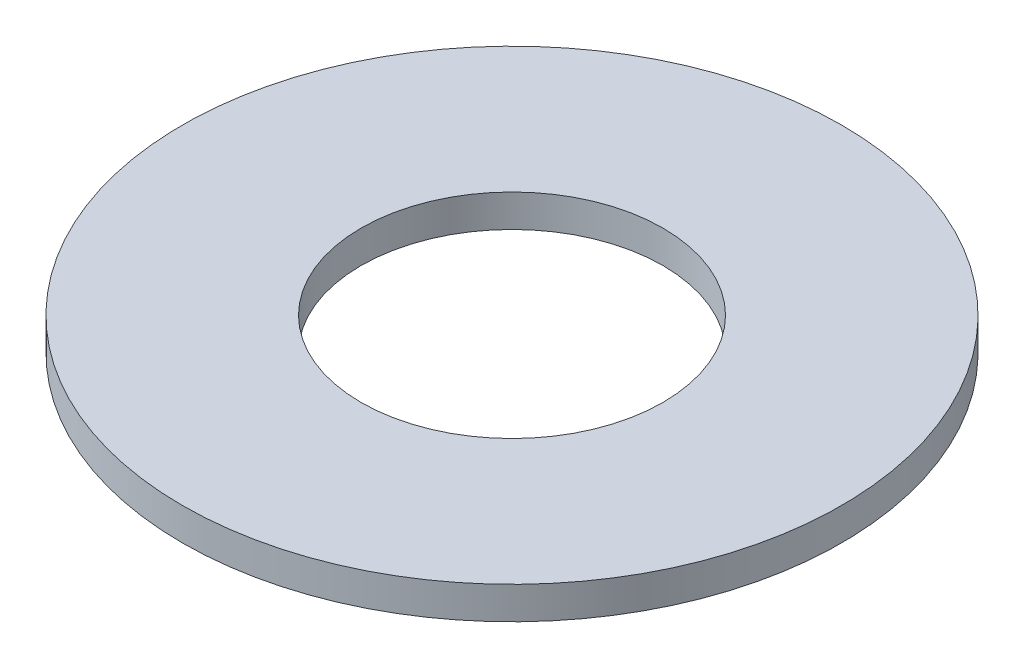
from build123d import *

# Parameters (mm, degrees)
SKETCH1_R           = 2.5781
SKETCH1_R_2         = 1.1811
BOSS_EXTRUDE1_DEPTH = 0.254


with BuildPart() as part:
    # Sketch1 → Boss-Extrude1 (new body)
    with BuildSketch(Plane(origin=(0, 0, 0), x_dir=(1, 0, 0), z_dir=(0, 1, 0))):
        with Locations(Location((0, 0, 0), (0, 0, 270))):
            Circle(SKETCH1_R)
        with Locations(Location((0, 0, 0), (0, 0, 270))):
            Circle(SKETCH1_R_2, mode=Mode.SUBTRACT)
    extrude(amount=BOSS_EXTRUDE1_DEPTH)


solid = part.part
